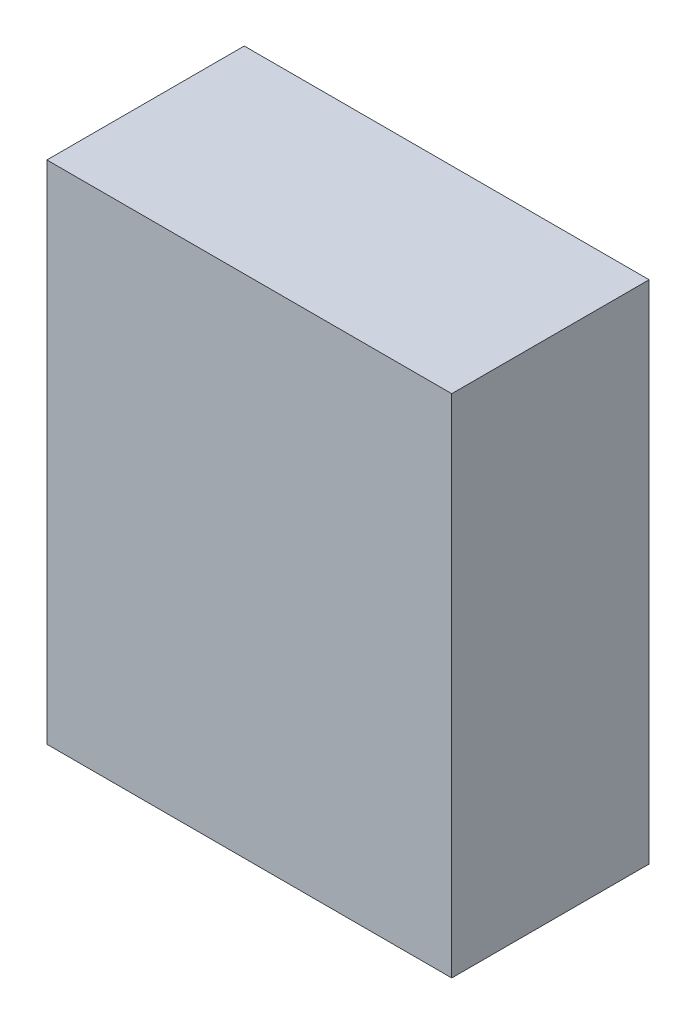
from build123d import *

# Parameters (mm, degrees)
SKETCH1_W           = 40
SKETCH1_H           = 50
BOSS_EXTRUDE1_DEPTH = 19.5


with BuildPart() as part:
    # Sketch1 → Boss-Extrude1 (new body)
    with BuildSketch(Plane.XY):
        with Locations((-18.444444444, -2)):
            Rectangle(SKETCH1_W, SKETCH1_H)
    extrude(amount=BOSS_EXTRUDE1_DEPTH)


solid = part.part
